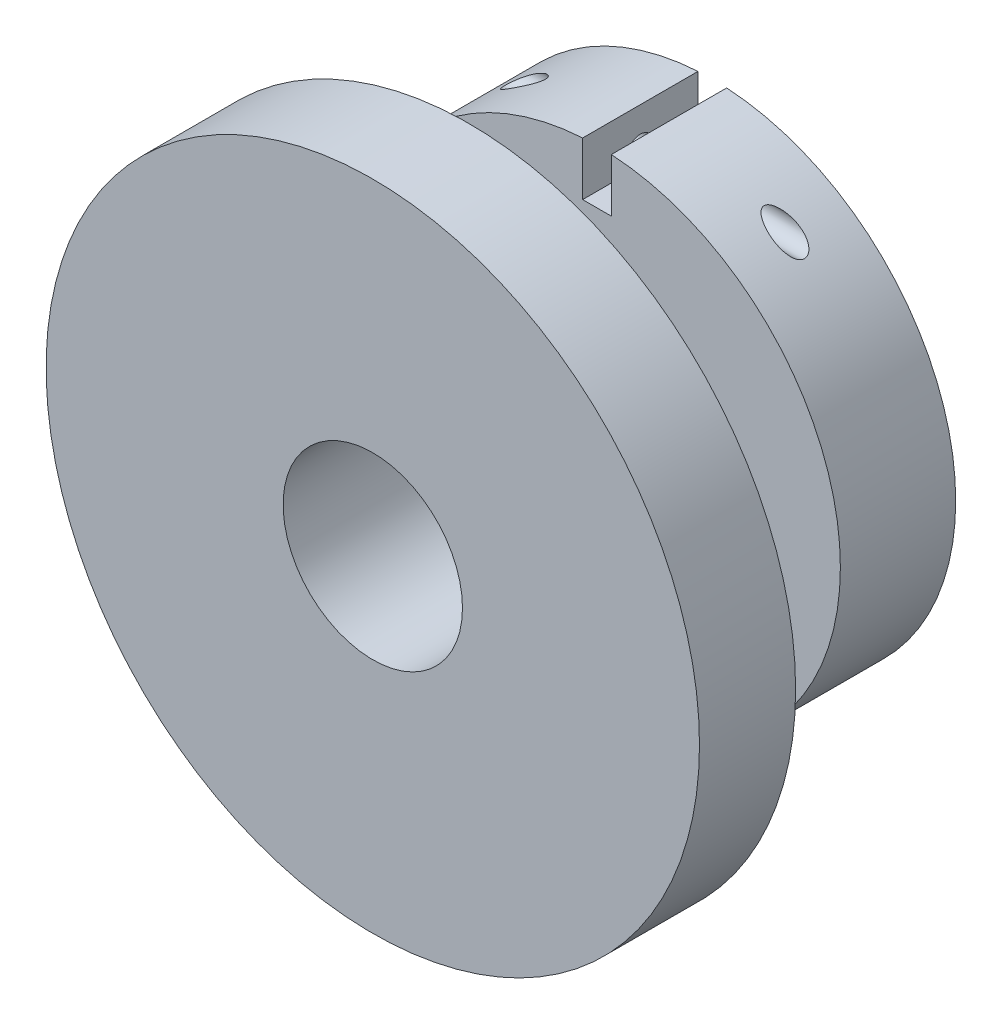
from build123d import *

# Parameters (mm, degrees)
ESQUISSE1_R                  = 67.85
ESQUISSE1_R_2                = 50
BOSS_EXTRU_1_DEPTH           = 71.4
ESQUISSE3_R                  = 135.7
ESQUISSE3_R_2                = 50
BOSS_EXTRU_2_DEPTH           = 64.3
ENL_V_MAT_EXTRU_2_DEPTH      = 236.039294587
ENL_V_MAT_EXTRU_3_DEPTH      = 235.903107685
ENL_V_MAT_EXTRU_3_DEPTH_BACK = 235.903107685
ESQUISSE7_R                  = 7.15
BOSS_EXTRU_3_START           = 53.6
ESQUISSE8_R                  = 182.15
ESQUISSE8_R_2                = 50
BOSS_EXTRU_3_DEPTH           = 53.6


with BuildPart() as part:
    # Esquisse1 → Boss.-Extru.1 (new body)
    with BuildSketch(Plane.XY):
        Circle(ESQUISSE1_R)
        Circle(ESQUISSE1_R_2, mode=Mode.SUBTRACT)
    extrude(amount=-BOSS_EXTRU_1_DEPTH)

    # Esquisse3 → Boss.-Extru.2 (add)
    with BuildSketch(Plane(origin=(0, 0, -71.4), x_dir=(-1, 0, 0), z_dir=(0, 0, -1))):
        Circle(ESQUISSE3_R)
        with Locations(Location((0, 0, 0), (0, 0, 180))):
            Circle(ESQUISSE3_R_2, mode=Mode.SUBTRACT)
    extrude(amount=BOSS_EXTRU_2_DEPTH)

    # Esquisse6 → Enlèv. mat.-Extru.2 (cut, through all)
    with BuildSketch(Plane(origin=(0, 0, -135.7), x_dir=(-1, 0, 0), z_dir=(0, 0, -1))):
        with BuildLine():
            Line((-8, 105.7), (8, 105.7))
            Line((8, 105.7), (8, 135.463980452))
            ThreePointArc((8, 135.463980452), (0, 135.7), (-8, 135.463980452))
            Line((-8, 135.463980452), (-8, 105.7))
        make_face()
        with BuildLine():
            Line((8, -105.7), (8, -135.463980452))
            ThreePointArc((8, -135.463980452), (0, -135.7), (-8, -135.463980452))
            Line((-8, -135.463980452), (-8, -105.7))
            Line((-8, -105.7), (8, -105.7))
        make_face()
    extrude(amount=-ENL_V_MAT_EXTRU_2_DEPTH, mode=Mode.SUBTRACT)

    # Esquisse7 → Enlèv. mat.-Extru.3 (cut, two sides: drawn at the far end of the back side and taken through both)
    with BuildSketch(Plane(origin=(0, 0, 0), x_dir=(0, 0, -1), z_dir=(1, 0, 0)).offset(-ENL_V_MAT_EXTRU_3_DEPTH_BACK)):
        with Locations((103.55, 114.063980452)):
            Circle(ESQUISSE7_R)
        with Locations((103.55, -114.063980452)):
            Circle(ESQUISSE7_R)
    extrude(amount=ENL_V_MAT_EXTRU_3_DEPTH + ENL_V_MAT_EXTRU_3_DEPTH_BACK, mode=Mode.SUBTRACT)

    # Esquisse8 → Boss.-Extru.3 (add)
    with BuildSketch(Plane.XY.offset(BOSS_EXTRU_3_START)):
        Circle(ESQUISSE8_R)
        Circle(ESQUISSE8_R_2, mode=Mode.SUBTRACT)
    extrude(amount=-BOSS_EXTRU_3_DEPTH)


solid = part.part
